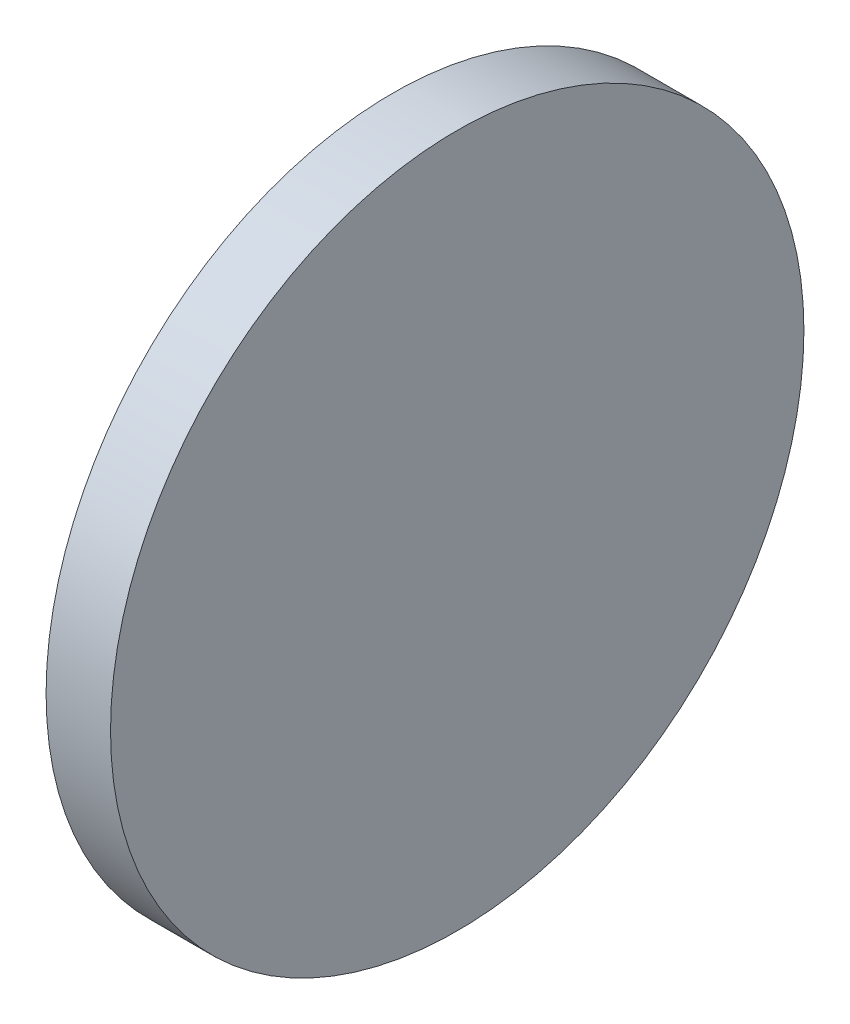
from build123d import *

# Parameters (mm, degrees)
SKETCH1_W = 1.5748
SKETCH1_H = 8.4709


with BuildPart() as part:
    # Sketch1 → Revolve1 (revolve)
    with BuildSketch(Plane(origin=(0, 0, 0), x_dir=(1, 0, 0), z_dir=(0, 1, 0)), mode=Mode.PRIVATE) as revolve1_sk:
        with Locations((0, 4.23545)):
            Rectangle(SKETCH1_W, SKETCH1_H)
    revolve(revolve1_sk.sketch.rotate(Axis((-0.7874, 0, 0), (1, 0, 0)), 180), axis=Axis((-0.7874, 0, 0), (1, 0, 0)))


solid = part.part
